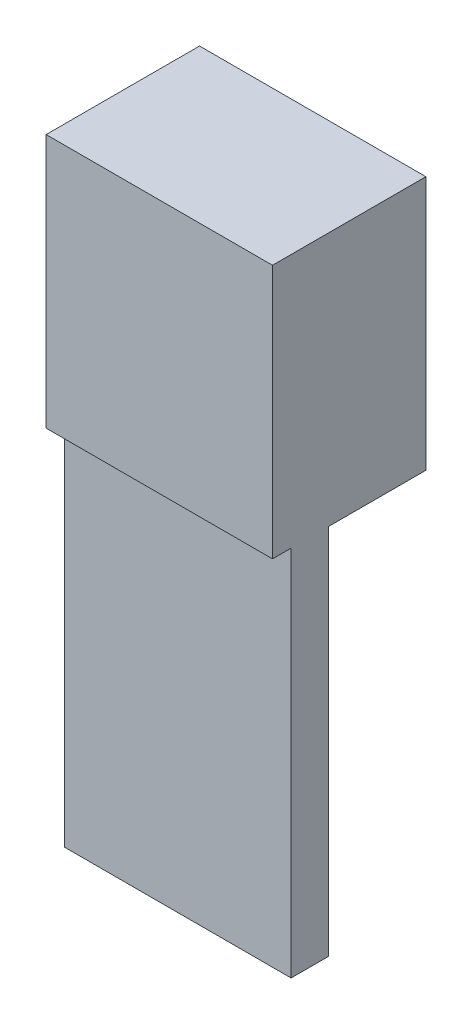
from build123d import *

# Parameters (mm, degrees)
SKETCH_1_W         = 6.08
SKETCH_1_H         = 6.83
EXTRUDE_1_DEPTH    = 4.12
SKETCH_2_R         = 2.35
EXTRUDE_2_DEPTH    = 0.1
DOME_1_FACE_RADIUS = 2.35
DOME_1_HEIGHT      = 1.45
SKETCH_4_W         = 6.08
SKETCH_4_H         = 1
EXTRUDE_1_2_DEPTH  = 10


with BuildPart() as part:
    # 草图1 → Extrude 1 (new body)
    with BuildSketch(Plane.XY):
        Rectangle(SKETCH_1_W, SKETCH_1_H)
    extrude(amount=EXTRUDE_1_DEPTH)

    # 草图2 → 拉伸2 (add)
    with BuildSketch(Plane(origin=(0, 0, 0), x_dir=(-1, 0, 0), z_dir=(0, 0, -1))):
        with Locations(Location((0, 0.565, 0), (0, 0, 180))):
            Circle(SKETCH_2_R)
    extrude(amount=EXTRUDE_2_DEPTH)

    # 圆顶1: a dome of height H over a round flat face of radius A is a cap of a sphere of radius (A * A + H * H) / (2 * H)
    dome_1_r = (DOME_1_FACE_RADIUS * DOME_1_FACE_RADIUS + DOME_1_HEIGHT * DOME_1_HEIGHT) / (2 * DOME_1_HEIGHT)
    dome_1_base = Plane((0, 0.565, -0.1), z_dir=(0, 0, -1))
    with Locations(dome_1_base.offset(DOME_1_HEIGHT - dome_1_r)):
        dome_1_ball = Sphere(dome_1_r, mode=Mode.PRIVATE)
    add(split(dome_1_ball, bisect_by=dome_1_base, keep=Keep.TOP, mode=Mode.PRIVATE))

    # 草图4 → Extrude 1 2 (add)
    with BuildSketch(Plane.XZ.offset(3.415)):
        with Locations((0, 3.12)):
            Rectangle(SKETCH_4_W, SKETCH_4_H)
    extrude(amount=EXTRUDE_1_2_DEPTH)


solid = part.part
